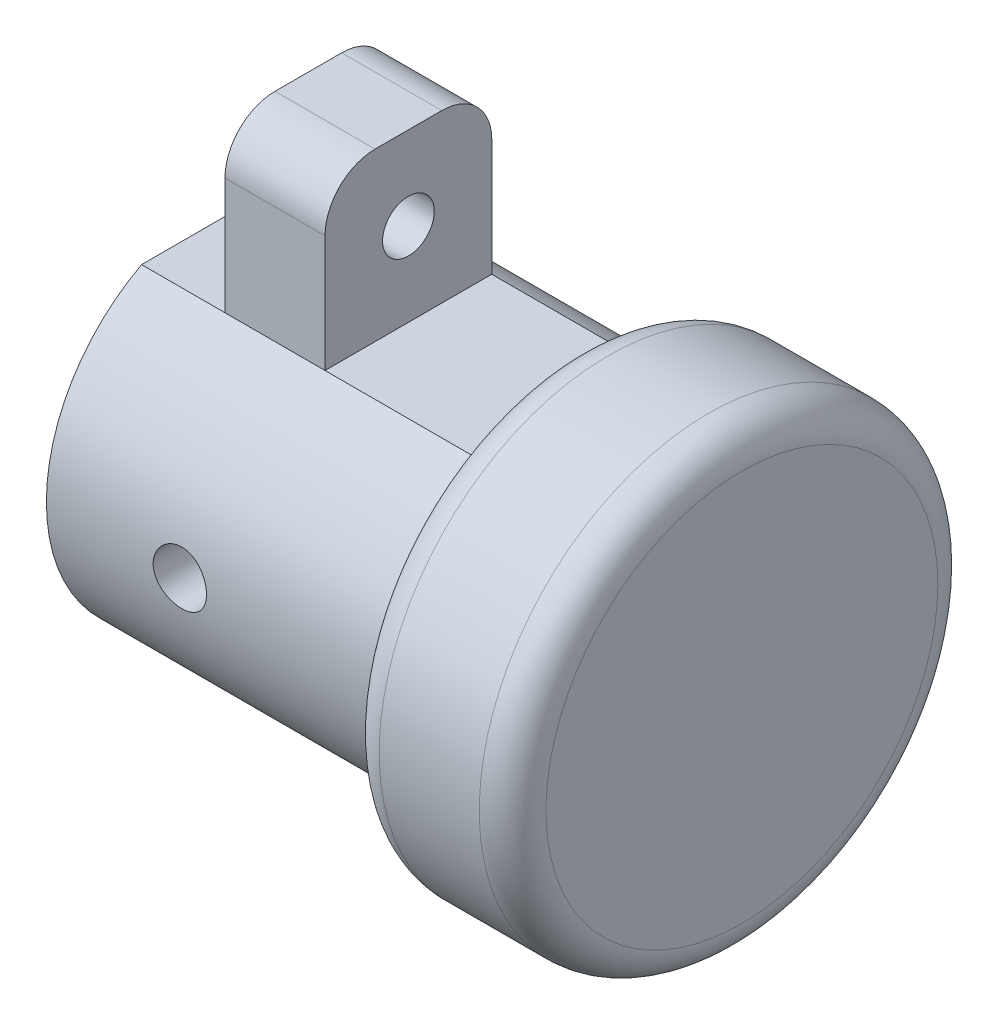
from build123d import *

# Parameters (mm, degrees)
SKETCH1_R           = 10.71
SKETCH1_R_2         = 7.71
SKETCH1_W           = 10
SKETCH1_H           = 10
BOSS_EXTRUDE1_DEPTH = 16
SKETCH2_R           = 1.55
CUT_EXTRUDE1_DEPTH  = 34.263383725
SKETCH3_R           = 1.6
CUT_EXTRUDE2_DEPTH  = 34.074839332
CUT_EXTRUDE4_START  = -10
SKETCH4_W           = 5
SKETCH4_H           = 10
CUT_EXTRUDE4_DEPTH  = 10
FILLET1_R           = 3
BOSS_EXTRUDE2_DEPTH = 15
SKETCH10_R          = 13.75
SKETCH10_R_2        = 1.5
BOSS_EXTRUDE3_DEPTH = 10
FILLET2_R           = 2


with BuildPart() as part:
    # Sketch1 → Boss-Extrude1 (new body)
    # profile 1 of 2: a face of its own
    with BuildSketch(Plane(origin=(0, 0, 0), x_dir=(0, 0, -1), z_dir=(1, 0, 0))):
        Circle(SKETCH1_R)
        Circle(SKETCH1_R_2, mode=Mode.SUBTRACT)
    # profile 2 of 2: a face of its own
    with BuildSketch(Plane(origin=(0, 0, 0), x_dir=(0, 0, -1), z_dir=(1, 0, 0))):
        with Locations((0, 14.471224842)):
            Rectangle(SKETCH1_W, SKETCH1_H)
    extrude(amount=BOSS_EXTRUDE1_DEPTH)

    # Sketch2 → Cut-Extrude1 (cut, through all)
    with BuildSketch(Plane(origin=(16, 0, 11), x_dir=(0, 0, 1), z_dir=(-1, 0, 0))):
        with Locations((-11, 14.471224842)):
            Circle(SKETCH2_R)
    extrude(amount=CUT_EXTRUDE1_DEPTH, mode=Mode.SUBTRACT)

    # Sketch3 → Cut-Extrude2 (cut, through all)
    with BuildSketch(Plane.XY.offset(10.71)):
        with Locations((8, 0)):
            Circle(SKETCH3_R)
    extrude(amount=-CUT_EXTRUDE2_DEPTH, mode=Mode.SUBTRACT)

    # Sketch4 → Cut-Extrude4 (cut)
    with BuildSketch(Plane(origin=(0, 19.471224842, 0), x_dir=(1, 0, 0), z_dir=(0, 1, 0)).offset(CUT_EXTRUDE4_START)):
        with Locations((2.5, 0)):
            Rectangle(SKETCH4_W, SKETCH4_H)
        with Locations((13.5, 0)):
            Rectangle(SKETCH4_W, SKETCH4_H)
    extrude(amount=CUT_EXTRUDE4_DEPTH, mode=Mode.SUBTRACT)

    # Fillet1
    fillet1_edges = [part.edges().sort_by_distance(p)[0] for p in [
        (8, 19.471224842, 5),
        (8, 19.471224842, -5),
    ]]
    fillet(fillet1_edges, radius=FILLET1_R)

    # Sketch8 → Boss-Extrude2 (add)
    with BuildSketch(Plane(origin=(16, 0, 0), x_dir=(0, 0, -1), z_dir=(1, 0, 0))):
        with BuildLine():
            Line((5, 9.471224842), (-5, 9.471224842))
            ThreePointArc((-5, 9.471224842), (0, -10.71), (5, 9.471224842))
        make_face()
    extrude(amount=BOSS_EXTRUDE2_DEPTH)

    # Sketch10 → Boss-Extrude3 (add)
    with BuildSketch(Plane(origin=(31, 0, 0), x_dir=(0, 0, -1), z_dir=(1, 0, 0))):
        Circle(SKETCH10_R)
        Circle(SKETCH10_R_2, mode=Mode.SUBTRACT)
    extrude(amount=-BOSS_EXTRUDE3_DEPTH)

    # Fillet2
    fillet2_edges = [part.edges().sort_by_distance(p)[0] for p in [
        (31, 0, 13.75),
        (21, 0, 13.75),
    ]]
    fillet(fillet2_edges, radius=FILLET2_R)


solid = part.part
